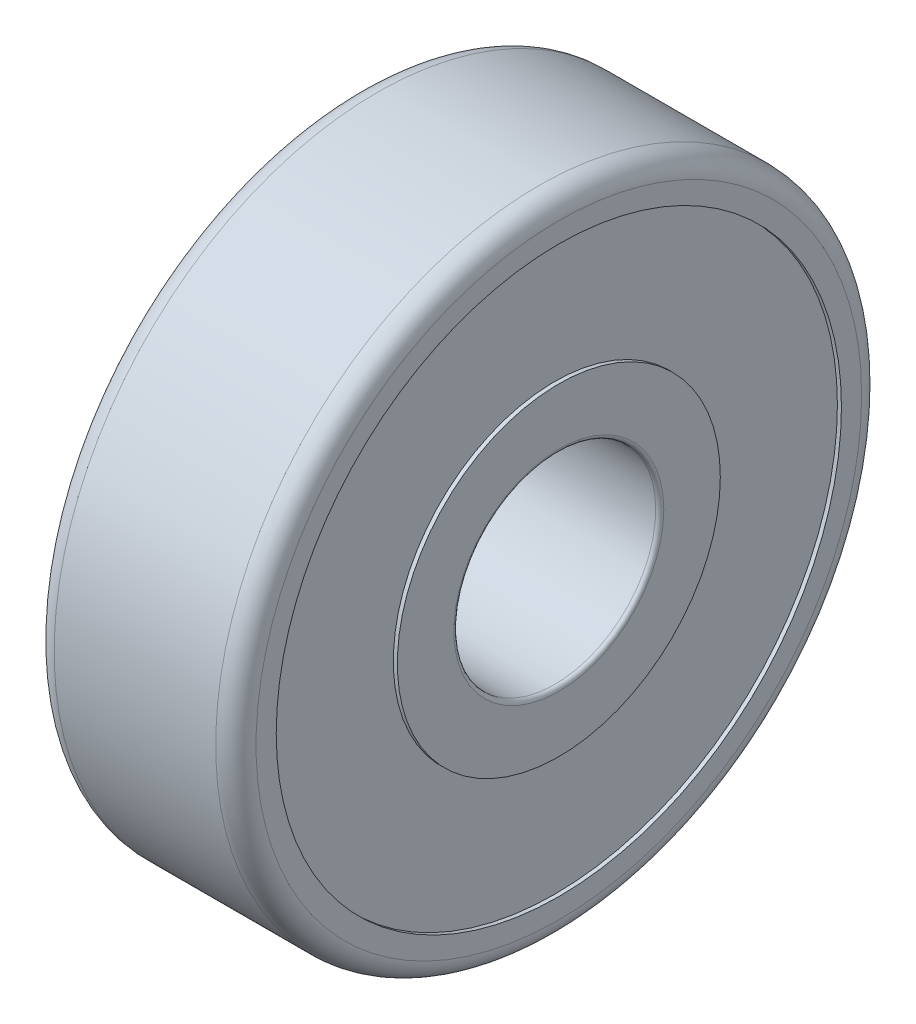
from build123d import *

# Parameters (mm, degrees)
SALIENTE_EXTRUIR2_DEPTH      = 2.5
SALIENTE_EXTRUIR2_DEPTH_BACK = 2.5
CROQUIS2_R                   = 8
CROQUIS2_R_2                 = 2.5
REDONDEO1_R                  = 0.5
REDONDEO2_R                  = 0.1
CROQUIS3_R                   = 7
CROQUIS3_R_2                 = 4
CORTAR_EXTRUIR1_DEPTH        = 0.1
CORTAR_EXTRUIR2_START        = -0.1
CROQUIS4_R                   = 7
CROQUIS4_R_2                 = 4
CORTAR_EXTRUIR2_DEPTH        = 0.1


with BuildPart() as part:
    # Croquis2 → Saliente-Extruir2 (new, two sides: drawn at the far end of the back side and taken through both)
    with BuildSketch(Plane(origin=(0, 0, 0), x_dir=(0, 0, -1), z_dir=(1, 0, 0)).offset(-SALIENTE_EXTRUIR2_DEPTH_BACK)):
        Circle(CROQUIS2_R)
        Circle(CROQUIS2_R_2, mode=Mode.SUBTRACT)
    extrude(amount=SALIENTE_EXTRUIR2_DEPTH + SALIENTE_EXTRUIR2_DEPTH_BACK)

    # Redondeo1
    redondeo1_edges = [part.edges().sort_by_distance(p)[0] for p in [
        (-2.5, 0, 8),
        (2.5, 0, 8),
    ]]
    fillet(redondeo1_edges, radius=REDONDEO1_R)

    # Redondeo2
    redondeo2_edges = [part.edges().sort_by_distance(p)[0] for p in [
        (-2.5, 0, 2.5),
        (2.5, 0, 2.5),
    ]]
    fillet(redondeo2_edges, radius=REDONDEO2_R)

    # Croquis3 → Cortar-Extruir1 (cut)
    with BuildSketch(Plane.ZY.offset(2.5)):
        Circle(CROQUIS3_R)
        Circle(CROQUIS3_R_2, mode=Mode.SUBTRACT)
    extrude(amount=-CORTAR_EXTRUIR1_DEPTH, mode=Mode.SUBTRACT)

    # Croquis4 → Cortar-Extruir2 (cut)
    with BuildSketch(Plane(origin=(2.5, 0, 0), x_dir=(0, 0, -1), z_dir=(1, 0, 0)).offset(CORTAR_EXTRUIR2_START)):
        with Locations(Location((0, 0, 0), (0, 0, 180))):
            Circle(CROQUIS4_R)
        with Locations(Location((0, 0, 0), (0, 0, 180))):
            Circle(CROQUIS4_R_2, mode=Mode.SUBTRACT)
    extrude(amount=CORTAR_EXTRUIR2_DEPTH, mode=Mode.SUBTRACT)


solid = part.part
